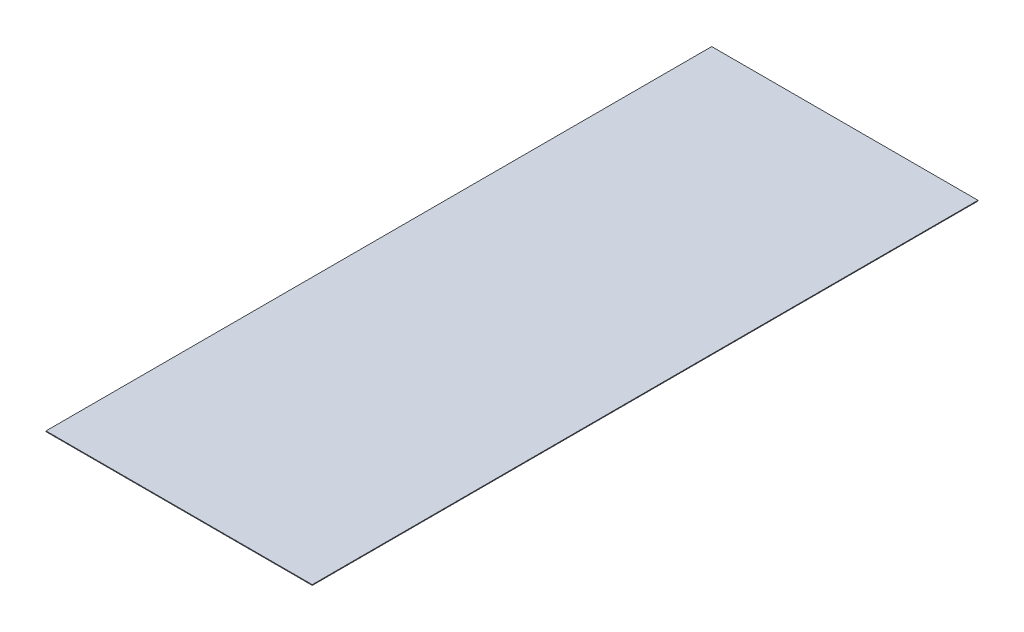
from build123d import *

# Parameters (mm, degrees)
CROQUIS1_W              = 1219.2
CROQUIS1_H              = 3048
SALIENTE_EXTRUIR1_DEPTH = 3.2


with BuildPart() as part:
    # Croquis1 → Saliente-Extruir1 (new body)
    with BuildSketch(Plane(origin=(0, 0, 0), x_dir=(1, 0, 0), z_dir=(0, 1, 0))):
        Rectangle(CROQUIS1_W, CROQUIS1_H)
    extrude(amount=SALIENTE_EXTRUIR1_DEPTH)


solid = part.part
